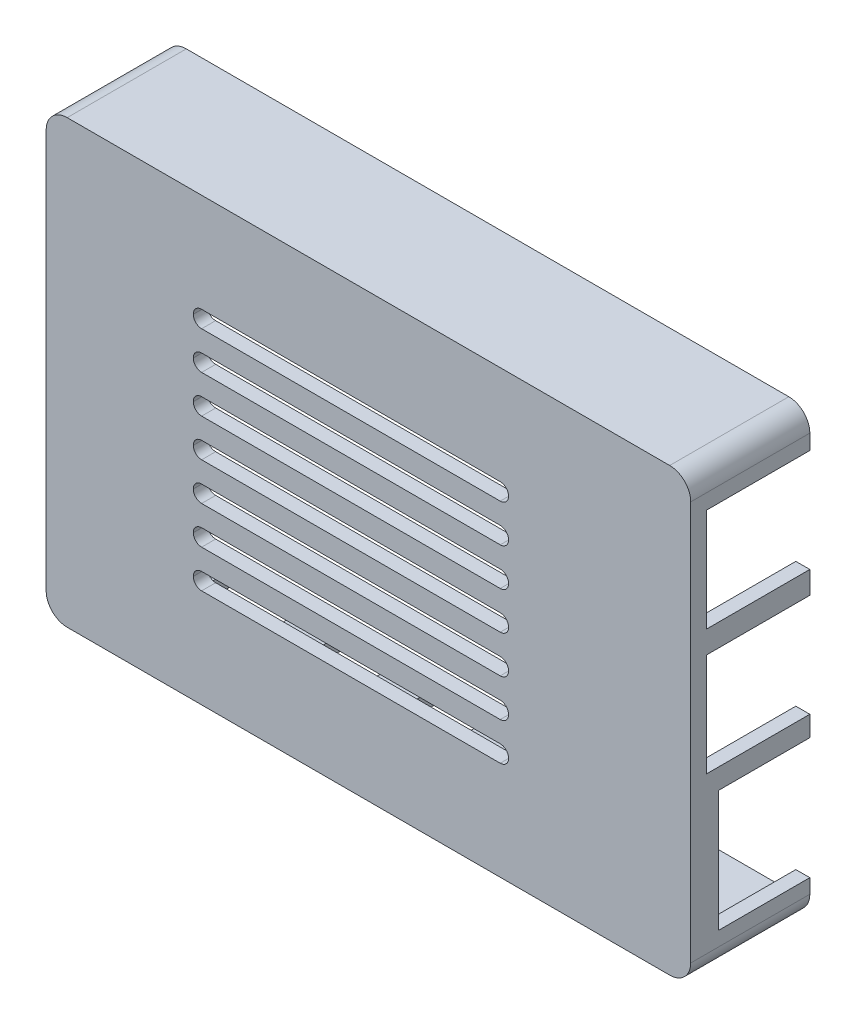
from build123d import *

# Parameters (mm, degrees)
TOP_ENVELOPE_START         = 8
CASEENVELOPE_W             = 92
CASEENVELOPE_H             = 63
TOP_ENVELOPE_DEPTH         = 17
OUTSIDE_R3_R               = 3
SHELL_1_T                  = -2
SIDEPORT_CLEARANCE_1_START = 6.45
SIDEPORT_PROFILE_1_W       = 10.1
SIDEPORT_PROFILE_1_H       = 13
SIDEPORT_CLEARANCE_1_DEPTH = 4.5
SIDEPORT_CLEARANCE_2_START = 6.45
SIDEPORT_PROFILE_2_W       = 7.7
SIDEPORT_PROFILE_2_H       = 13
SIDEPORT_CLEARANCE_2_DEPTH = 4.7
SIDEPORT_CLEARANCE_3_START = 6.45
SIDEPORT_PROFILE_3_W       = 7.7
SIDEPORT_PROFILE_3_H       = 13
SIDEPORT_CLEARANCE_3_DEPTH = 4.7
ENDPORT_CLEARANCE_1_START  = 6.45
ENDPORT_PROFILE_1_W        = 11
ENDPORT_PROFILE_1_H        = 17.3
ENDPORT_CLEARANCE_1_DEPTH  = 14.6
ENDPORT_CLEARANCE_2_START  = 6.45
ENDPORT_PROFILE_2_W        = 11
ENDPORT_PROFILE_2_H        = 14.7
ENDPORT_CLEARANCE_2_DEPTH  = 16.3
ENDPORT_CLEARANCE_3_START  = 6.45
ENDPORT_PROFILE_3_W        = 11
ENDPORT_PROFILE_3_H        = 14.7
ENDPORT_CLEARANCE_3_DEPTH  = 16.3
COOLING_SLOTS_START        = 22.5
COOLING_SLOTS_DEPTH        = 3


with BuildPart() as part:
    # CaseEnvelope → Top_Envelope (new body)
    with BuildSketch(Plane.XY.offset(TOP_ENVELOPE_START)):
        Rectangle(CASEENVELOPE_W, CASEENVELOPE_H)
    extrude(amount=TOP_ENVELOPE_DEPTH)

    # Outside_R3
    outside_r3_edges = [part.edges().sort_by_distance(p)[0] for p in [
        (46, 31.5, 16.5),
        (46, -31.5, 16.5),
        (-46, 31.5, 16.5),
        (-46, -31.5, 16.5),
    ]]
    fillet(outside_r3_edges, radius=OUTSIDE_R3_R)

    # 抽壳1
    shell_1_openings = [part.faces().sort_by_distance(p)[0] for p in [
        (0, 0, 8),
    ]]
    offset(amount=SHELL_1_T, openings=shell_1_openings, kind=Kind.INTERSECTION)

    # SidePort_Profile_1 → SidePort_Clearance_1 (cut)
    with BuildSketch(Plane.XY.offset(SIDEPORT_CLEARANCE_1_START)):
        with Locations((-31.3, -33.5)):
            Rectangle(SIDEPORT_PROFILE_1_W, SIDEPORT_PROFILE_1_H)
    extrude(amount=SIDEPORT_CLEARANCE_1_DEPTH, mode=Mode.SUBTRACT)

    # SidePort_Profile_2 → SidePort_Clearance_2 (cut)
    with BuildSketch(Plane.XY.offset(SIDEPORT_CLEARANCE_2_START)):
        with Locations((-16.7, -33.5)):
            Rectangle(SIDEPORT_PROFILE_2_W, SIDEPORT_PROFILE_2_H)
    extrude(amount=SIDEPORT_CLEARANCE_2_DEPTH, mode=Mode.SUBTRACT)

    # SidePort_Profile_3 → SidePort_Clearance_3 (cut)
    with BuildSketch(Plane.XY.offset(SIDEPORT_CLEARANCE_3_START)):
        with Locations((-3.3, -33.5)):
            Rectangle(SIDEPORT_PROFILE_3_W, SIDEPORT_PROFILE_3_H)
    extrude(amount=SIDEPORT_CLEARANCE_3_DEPTH, mode=Mode.SUBTRACT)

    # EndPort_Profile_1 → EndPort_Clearance_1 (cut)
    with BuildSketch(Plane.XY.offset(ENDPORT_CLEARANCE_1_START)):
        with Locations((47.5, -17.8)):
            Rectangle(ENDPORT_PROFILE_1_W, ENDPORT_PROFILE_1_H)
    extrude(amount=ENDPORT_CLEARANCE_1_DEPTH, mode=Mode.SUBTRACT)

    # EndPort_Profile_2 → EndPort_Clearance_2 (cut)
    with BuildSketch(Plane.XY.offset(ENDPORT_CLEARANCE_2_START)):
        with Locations((47.5, 1.1)):
            Rectangle(ENDPORT_PROFILE_2_W, ENDPORT_PROFILE_2_H)
    extrude(amount=ENDPORT_CLEARANCE_2_DEPTH, mode=Mode.SUBTRACT)

    # EndPort_Profile_3 → EndPort_Clearance_3 (cut)
    with BuildSketch(Plane.XY.offset(ENDPORT_CLEARANCE_3_START)):
        with Locations((47.5, 19)):
            Rectangle(ENDPORT_PROFILE_3_W, ENDPORT_PROFILE_3_H)
    extrude(amount=ENDPORT_CLEARANCE_3_DEPTH, mode=Mode.SUBTRACT)

    # Cooling_Slot_Profiles → Cooling_Slots (cut)
    with BuildSketch(Plane.XY.offset(COOLING_SLOTS_START)):
        with BuildLine():
            Line((-23.81, -17.4), (18.81, -17.4))
            ThreePointArc((18.81, -17.4), (19.65145707, -17.05145707), (20, -16.21))
            Line((20, -16.21), (20, -16.19))
            ThreePointArc((20, -16.19), (19.65145707, -15.34854293), (18.81, -15))
            Line((18.81, -15), (-23.81, -15))
            ThreePointArc((-23.81, -15), (-24.65145707, -15.34854293), (-25, -16.19))
            Line((-25, -16.19), (-25, -16.21))
            ThreePointArc((-25, -16.21), (-24.65145707, -17.05145707), (-23.81, -17.4))
        make_face()
        with BuildLine():
            Line((-23.81, -12), (18.81, -12))
            ThreePointArc((18.81, -12), (19.65145707, -11.65145707), (20, -10.81))
            Line((20, -10.81), (20, -10.79))
            ThreePointArc((20, -10.79), (19.65145707, -9.94854293), (18.81, -9.6))
            Line((18.81, -9.6), (-23.81, -9.6))
            ThreePointArc((-23.81, -9.6), (-24.65145707, -9.94854293), (-25, -10.79))
            Line((-25, -10.79), (-25, -10.81))
            ThreePointArc((-25, -10.81), (-24.65145707, -11.65145707), (-23.81, -12))
        make_face()
        with BuildLine():
            Line((-23.81, -6.6), (18.81, -6.6))
            ThreePointArc((18.81, -6.6), (19.65145707, -6.25145707), (20, -5.41))
            Line((20, -5.41), (20, -5.39))
            ThreePointArc((20, -5.39), (19.65145707, -4.54854293), (18.81, -4.2))
            Line((18.81, -4.2), (-23.81, -4.2))
            ThreePointArc((-23.81, -4.2), (-24.65145707, -4.54854293), (-25, -5.39))
            Line((-25, -5.39), (-25, -5.41))
            ThreePointArc((-25, -5.41), (-24.65145707, -6.25145707), (-23.81, -6.6))
        make_face()
        with BuildLine():
            Line((-23.81, -1.2), (18.81, -1.2))
            ThreePointArc((18.81, -1.2), (19.65145707, -0.85145707), (20, -0.01))
            Line((20, -0.01), (20, 0.01))
            ThreePointArc((20, 0.01), (19.65145707, 0.85145707), (18.81, 1.2))
            Line((18.81, 1.2), (-23.81, 1.2))
            ThreePointArc((-23.81, 1.2), (-24.65145707, 0.85145707), (-25, 0.01))
            Line((-25, 0.01), (-25, -0.01))
            ThreePointArc((-25, -0.01), (-24.65145707, -0.85145707), (-23.81, -1.2))
        make_face()
        with BuildLine():
            Line((-23.81, 4.2), (18.81, 4.2))
            ThreePointArc((18.81, 4.2), (19.65145707, 4.54854293), (20, 5.39))
            Line((20, 5.39), (20, 5.41))
            ThreePointArc((20, 5.41), (19.65145707, 6.25145707), (18.81, 6.6))
            Line((18.81, 6.6), (-23.81, 6.6))
            ThreePointArc((-23.81, 6.6), (-24.65145707, 6.25145707), (-25, 5.41))
            Line((-25, 5.41), (-25, 5.39))
            ThreePointArc((-25, 5.39), (-24.65145707, 4.54854293), (-23.81, 4.2))
        make_face()
        with BuildLine():
            Line((-23.81, 9.6), (18.81, 9.6))
            ThreePointArc((18.81, 9.6), (19.65145707, 9.94854293), (20, 10.79))
            Line((20, 10.79), (20, 10.81))
            ThreePointArc((20, 10.81), (19.65145707, 11.65145707), (18.81, 12))
            Line((18.81, 12), (-23.81, 12))
            ThreePointArc((-23.81, 12), (-24.65145707, 11.65145707), (-25, 10.81))
            Line((-25, 10.81), (-25, 10.79))
            ThreePointArc((-25, 10.79), (-24.65145707, 9.94854293), (-23.81, 9.6))
        make_face()
        with BuildLine():
            Line((-23.81, 15), (18.81, 15))
            ThreePointArc((18.81, 15), (19.65145707, 15.34854293), (20, 16.19))
            Line((20, 16.19), (20, 16.21))
            ThreePointArc((20, 16.21), (19.65145707, 17.05145707), (18.81, 17.4))
            Line((18.81, 17.4), (-23.81, 17.4))
            ThreePointArc((-23.81, 17.4), (-24.65145707, 17.05145707), (-25, 16.21))
            Line((-25, 16.21), (-25, 16.19))
            ThreePointArc((-25, 16.19), (-24.65145707, 15.34854293), (-23.81, 15))
        make_face()
    extrude(amount=COOLING_SLOTS_DEPTH, mode=Mode.SUBTRACT)


solid = part.part
